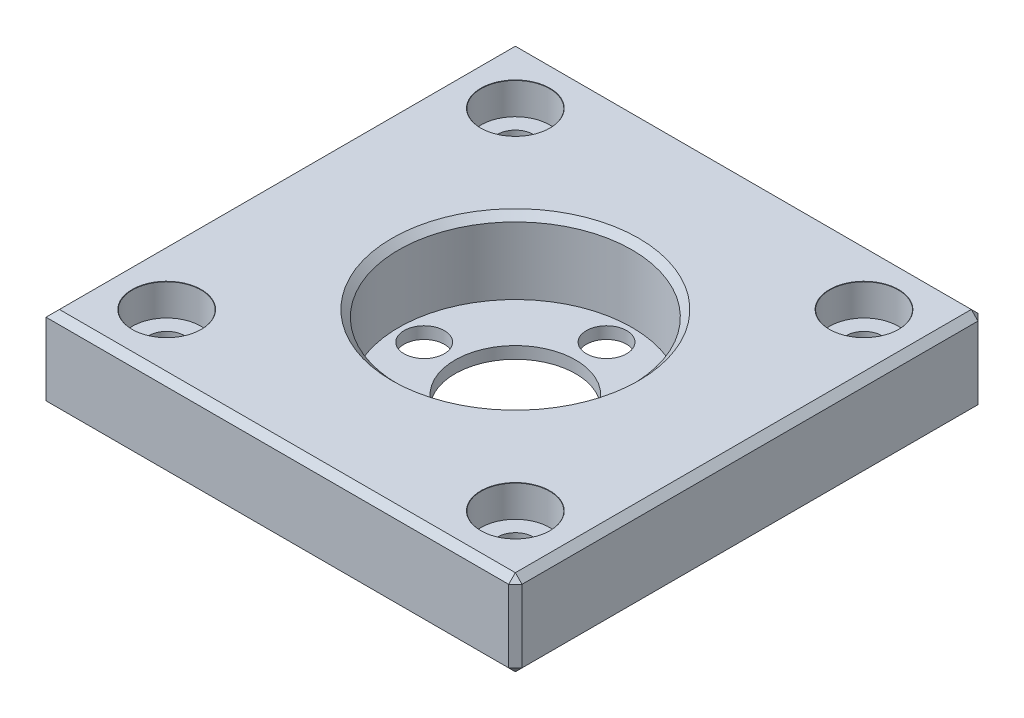
from build123d import *

# Parameters (mm, degrees)
SKETCH1_W                     = 44.45
SKETCH1_H                     = 44.45
BOSS_EXTRUDE1_DEPTH           = 8.128
SKETCH2_R                     = 11.05
CUT_EXTRUDE1_DEPTH            = 7
SKETCH3_R                     = 1.905
SKETCH3_R_2                   = 5.715
CUT_EXTRUDE2_DEPTH            = 64.250335967
CBORE_FOR_M3_SHCS1_AT_2_COUNT = 2
CBORE_FOR_M3_SHCS1_AT_2_PITCH = 33.02
CBORE_FOR_M3_SHCS1_AT_3_COUNT = 2
CBORE_FOR_M3_SHCS1_AT_3_PITCH = 46.69733183
CBORE_FOR_M3_SHCS1_AT_4_COUNT = 2
CBORE_FOR_M3_SHCS1_AT_4_PITCH = 33.02
CHAMFER1_SIZE                 = 0.635
CHAMFER2_SIZE                 = 0.635


with BuildPart() as part:
    # Sketch1 → Boss-Extrude1 (new body)
    with BuildSketch(Plane(origin=(0, 0, 0), x_dir=(1, 0, 0), z_dir=(0, 1, 0))):
        with Locations((22.225, 22.225)):
            Rectangle(SKETCH1_W, SKETCH1_H)
    extrude(amount=BOSS_EXTRUDE1_DEPTH)

    # Sketch2 → Cut-Extrude1 (cut)
    with BuildSketch(Plane(origin=(0, 8.128, 0), x_dir=(1, 0, 0), z_dir=(0, 1, 0))):
        with Locations(Location((22.225, 22.225, 0), (0, 0, 270))):
            Circle(SKETCH2_R)
    extrude(amount=-CUT_EXTRUDE1_DEPTH, mode=Mode.SUBTRACT)

    # Sketch3 → Cut-Extrude2 (cut, through all)
    with BuildSketch(Plane(origin=(0, 1.128, 0), x_dir=(1, 0, 0), z_dir=(0, 1, 0))):
        with Locations(Location((22.225, 30.861, 0), (0, 0, 270))):
            Circle(SKETCH3_R)
        with Locations(Location((30.861, 22.225, 0), (0, 0, 270))):
            Circle(SKETCH3_R)
        with Locations(Location((22.225, 13.589, 0), (0, 0, 270))):
            Circle(SKETCH3_R)
        with Locations(Location((13.589, 22.225, 0), (0, 0, 270))):
            Circle(SKETCH3_R)
        with Locations(Location((22.225, 22.225, 0), (0, 0, 270))):
            Circle(SKETCH3_R_2)
    extrude(amount=-CUT_EXTRUDE2_DEPTH, mode=Mode.SUBTRACT)

    # Sketch8 → CBORE for M3 SHCS1 (revolve, cut)
    with BuildSketch(Plane(origin=(5.715, 8.128, -38.735), x_dir=(0, 0, 1), z_dir=(1, 0, 0))):
        Polygon((0, 0), (0, 8.128), (1.7, 8.128), (1.7, 3), (3.25, 3), (3.25, 0.025), (3.275, 0), align=None)
    cbore_for_m3_shcs1 = revolve(axis=Axis((5.715, 14.478, -38.735), (0, -1, 0)), mode=Mode.SUBTRACT)

    # CBORE for M3 SHCS1 at 2: CBORE for M3 SHCS1 ×2
    with Locations(*[(i * CBORE_FOR_M3_SHCS1_AT_2_PITCH, 0, 0) for i in range(1, CBORE_FOR_M3_SHCS1_AT_2_COUNT)]):
        add(cbore_for_m3_shcs1, mode=Mode.SUBTRACT)

    # CBORE for M3 SHCS1 at 3: CBORE for M3 SHCS1 ×2
    with Locations(*[Vector(0.7071067811865477, 0, 0.7071067811865475) * (i * CBORE_FOR_M3_SHCS1_AT_3_PITCH) for i in range(1, CBORE_FOR_M3_SHCS1_AT_3_COUNT)]):
        add(cbore_for_m3_shcs1, mode=Mode.SUBTRACT)

    # CBORE for M3 SHCS1 at 4: CBORE for M3 SHCS1 ×2
    with Locations(*[(0, 0, i * CBORE_FOR_M3_SHCS1_AT_4_PITCH) for i in range(1, CBORE_FOR_M3_SHCS1_AT_4_COUNT)]):
        add(cbore_for_m3_shcs1, mode=Mode.SUBTRACT)

    # Chamfer1
    chamfer1_edges = [part.edges().sort_by_distance(p)[0] for p in [
        (44.45, 8.128, -22.225),
        (22.225, 8.128, -44.45),
        (0, 8.128, -22.225),
        (22.225, 0, -44.45),
        (44.45, 0, -22.225),
        (22.225, 0, 0),
        (0, 0, -22.225),
        (44.45, 4.064, -44.45),
        (44.45, 4.064, 0),
        (22.225, 8.128, 0),
    ]]
    chamfer(chamfer1_edges, length=CHAMFER1_SIZE)

    # Chamfer2
    chamfer2_edges = [part.edges().sort_by_distance(p)[0] for p in [
        (22.225, 8.128, -33.275),
    ]]
    chamfer(chamfer2_edges, length=CHAMFER2_SIZE)


solid = part.part
